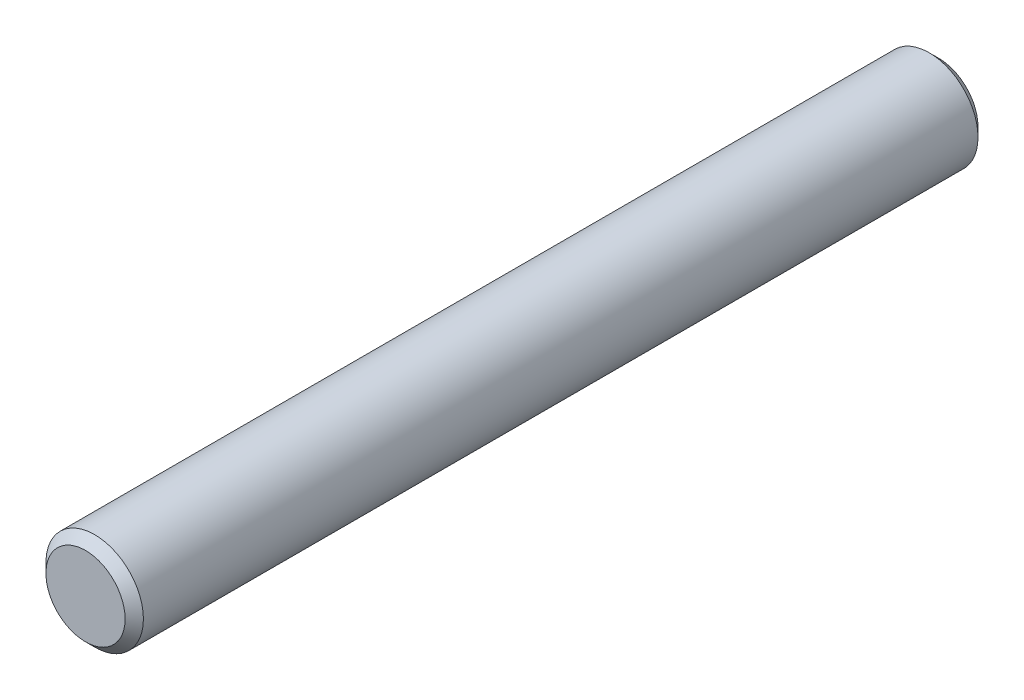
from build123d import *

# Parameters (mm, degrees)
SKETCH1_R           = 4
BOSS_EXTRUDE1_DEPTH = 70
CHAMFER1_SIZE       = 0.75


with BuildPart() as part:
    # Sketch1 → Boss-Extrude1 (new body)
    with BuildSketch(Plane.XY):
        Circle(SKETCH1_R)
    extrude(amount=BOSS_EXTRUDE1_DEPTH)

    # Chamfer1
    chamfer1_edges = [part.edges().sort_by_distance(p)[0] for p in [
        (-4, 0, 0),
        (-4, 0, 70),
    ]]
    chamfer(chamfer1_edges, length=CHAMFER1_SIZE)


solid = part.part
